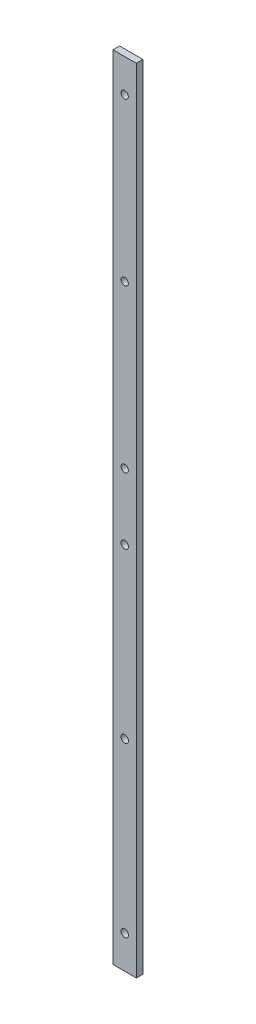
from build123d import *

# Parameters (mm, degrees)
CROQUIS2_R              = 1.65
CROQUIS2_R_2            = 1.7
SALIENTE_EXTRUIR1_DEPTH = 3


with BuildPart() as part:
    # Croquis2 → Saliente-Extruir1 (new body)
    with BuildSketch(Plane.XY):
        Polygon((65.549894739, -123.149288148), (76.151803136, -123.149288148), (76.151803136, 236.850888729), (65.549881, 236.850888729), align=None)
        with Locations((70.850842068, 221.850888729)):
            Circle(CROQUIS2_R, mode=Mode.SUBTRACT)
        with Locations((70.850842068, 148.300944492)):
            Circle(CROQUIS2_R, mode=Mode.SUBTRACT)
        with Locations((70.850842068, 74.751000255)):
            Circle(CROQUIS2_R, mode=Mode.SUBTRACT)
        with Locations((70.850848938, 44.751000255)):
            Circle(CROQUIS2_R_2, mode=Mode.SUBTRACT)
        with Locations((70.850848938, -31.699143946)):
            Circle(CROQUIS2_R_2, mode=Mode.SUBTRACT)
        with Locations((70.850848938, -108.149288148)):
            Circle(CROQUIS2_R_2, mode=Mode.SUBTRACT)
    extrude(amount=SALIENTE_EXTRUIR1_DEPTH)


solid = part.part
